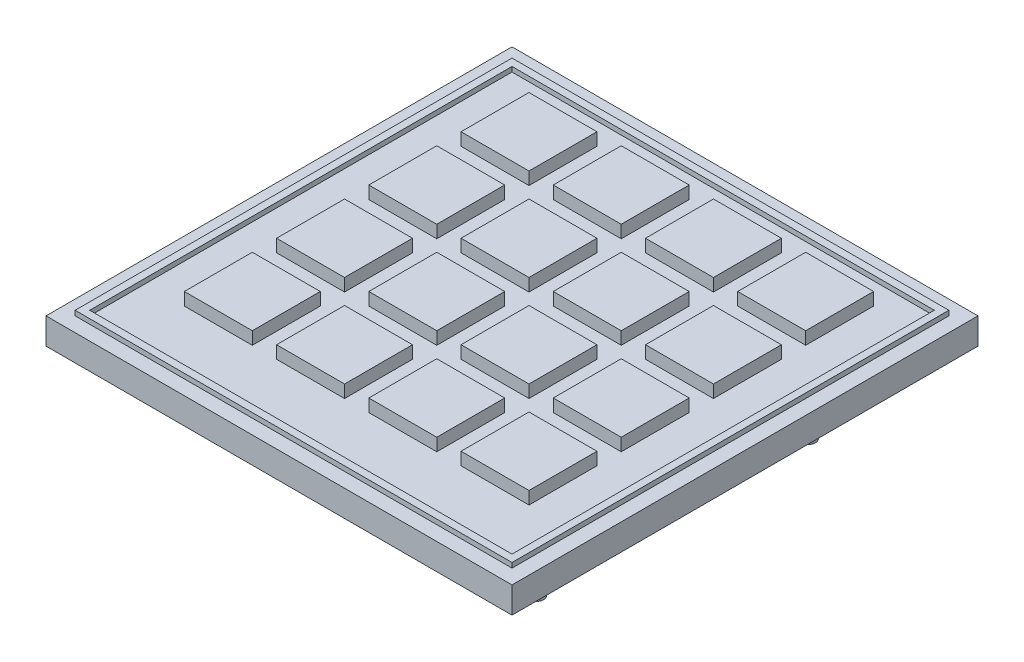
from build123d import *

# Parameters (mm, degrees)
SKETCH_1_W        = 96
SKETCH_1_H        = 96
EXTRUDE_1_DEPTH   = 5.4
SKETCH_2_W        = 14
SKETCH_2_H        = 14
EXTRUDE_2_DEPTH   = 2.6
SKETCH_4_W        = 90
SKETCH_4_H        = 90
SKETCH_4_W_2      = 87
SKETCH_4_H_2      = 87
EXTRUDE_1_2_DEPTH = 1
SKETCH_5_R        = 1.5
EXTRUDE_3_DEPTH   = 14


with BuildPart() as part:
    # Эскиз1 → Extrude 1 (new body)
    with BuildSketch(Plane(origin=(0, 0, 0), x_dir=(1, 0, 0), z_dir=(0, 1, 0))):
        with Locations((6.473253846, 2.11160233)):
            Rectangle(SKETCH_1_W, SKETCH_1_H)
    extrude(amount=EXTRUDE_1_DEPTH)

    # Эскиз2 → Бобышка-Вытянуть2 (add)
    with BuildSketch(Plane(origin=(0, 5.4, 0), x_dir=(1, 0, 0), z_dir=(0, 1, 0))):
        with Locations((-3.026746154, 34.11160233)):
            Rectangle(SKETCH_2_W, SKETCH_2_H)
        with Locations((-22.026746154, 34.11160233)):
            Rectangle(SKETCH_2_W, SKETCH_2_H)
        with Locations((15.973253846, 34.11160233)):
            Rectangle(SKETCH_2_W, SKETCH_2_H)
        with Locations((34.973253846, 34.11160233)):
            Rectangle(SKETCH_2_W, SKETCH_2_H)
        with Locations((-3.026746154, 15.11160233)):
            Rectangle(SKETCH_2_W, SKETCH_2_H)
        with Locations((-22.026746154, 15.11160233)):
            Rectangle(SKETCH_2_W, SKETCH_2_H)
        with Locations((15.973253846, 15.11160233)):
            Rectangle(SKETCH_2_W, SKETCH_2_H)
        with Locations((34.973253846, 15.11160233)):
            Rectangle(SKETCH_2_W, SKETCH_2_H)
        with Locations((-3.026746154, -3.88839767)):
            Rectangle(SKETCH_2_W, SKETCH_2_H)
        with Locations((-22.026746154, -3.88839767)):
            Rectangle(SKETCH_2_W, SKETCH_2_H)
        with Locations((15.973253846, -3.88839767)):
            Rectangle(SKETCH_2_W, SKETCH_2_H)
        with Locations((34.973253846, -3.88839767)):
            Rectangle(SKETCH_2_W, SKETCH_2_H)
        with Locations((-3.026746154, -22.88839767)):
            Rectangle(SKETCH_2_W, SKETCH_2_H)
        with Locations((-22.026746154, -22.88839767)):
            Rectangle(SKETCH_2_W, SKETCH_2_H)
        with Locations((15.973253846, -22.88839767)):
            Rectangle(SKETCH_2_W, SKETCH_2_H)
        with Locations((34.973253846, -22.88839767)):
            Rectangle(SKETCH_2_W, SKETCH_2_H)
    extrude(amount=EXTRUDE_2_DEPTH)

    # Эскиз4 → Extrude 1 2 (add)
    with BuildSketch(Plane(origin=(0, 5.4, 0), x_dir=(1, 0, 0), z_dir=(0, 1, 0))):
        with Locations((6.473253846, 2.11160233)):
            Rectangle(SKETCH_4_W, SKETCH_4_H)
        with Locations((6.473253846, 2.11160233)):
            Rectangle(SKETCH_4_W_2, SKETCH_4_H_2, mode=Mode.SUBTRACT)
    extrude(amount=EXTRUDE_1_2_DEPTH)

    # Эскиз5 → Бобышка-Вытянуть3 (add)
    with BuildSketch(Plane.XZ):
        with Locations(Location((39.473253846, 25.88839767, 0), (0, 0, 90))):
            Circle(SKETCH_5_R)
        with Locations(Location((-26.526746154, 25.88839767, 0), (0, 0, 90))):
            Circle(SKETCH_5_R)
        with Locations(Location((-26.526746154, -30.11160233, 0), (0, 0, 90))):
            Circle(SKETCH_5_R)
        with Locations(Location((39.473253846, -30.11160233, 0), (0, 0, 90))):
            Circle(SKETCH_5_R)
    extrude(amount=EXTRUDE_3_DEPTH)


solid = part.part
